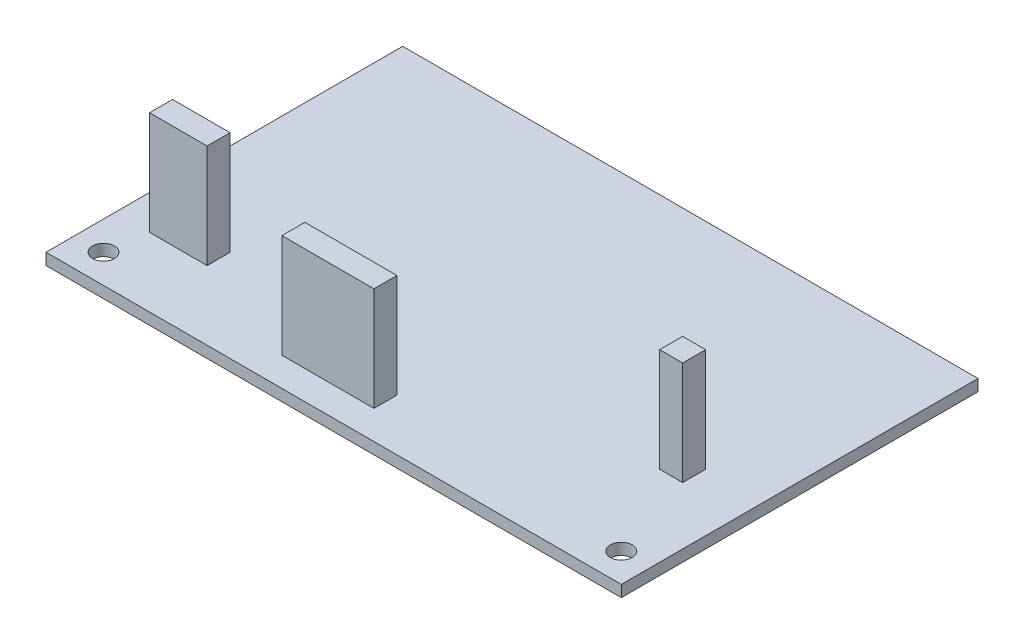
from build123d import *

# Parameters (mm, degrees)
BOSS_EXTRU_7_DEPTH      = 9
BOSS_EXTRU_7_DEPTH_BACK = 1
ESQUISSE1_W             = 8
ESQUISSE1_H             = 2
BOSS_EXTRU_8_DEPTH      = 9
BOSS_EXTRU_8_DEPTH_BACK = 1
ESQUISSE1_10_W          = 5
ESQUISSE1_10_H          = 2
BOSS_EXTRU_9_DEPTH      = 9
BOSS_EXTRU_9_DEPTH_BACK = 1
ESQUISSE1_11_W          = 2
ESQUISSE1_11_H          = 2
ESQUISSE1_12_W          = 50
ESQUISSE1_12_H          = 31
ESQUISSE1_12_R          = 0.95
ESQUISSE1_12_W_2        = 5
ESQUISSE1_12_H_2        = 2
ESQUISSE1_12_W_3        = 8
ESQUISSE1_12_W_4        = 2
BOSS_EXTRU_10_DEPTH     = 1


with BuildPart() as part:
    # Esquisse1 → Boss.-Extru.7 (new, two sides: drawn at the far end of the back side and taken through both)
    with BuildSketch(Plane(origin=(0, 0, 0), x_dir=(1, 0, 0), z_dir=(0, 1, 0)).offset(-BOSS_EXTRU_7_DEPTH_BACK)):
        with Locations((-0.479564033, -17.121253406)):
            Rectangle(ESQUISSE1_W, ESQUISSE1_H)
    extrude(amount=BOSS_EXTRU_7_DEPTH + BOSS_EXTRU_7_DEPTH_BACK)



with BuildPart() as body_2:
    # Esquisse1<10> → Boss.-Extru.8 (new, two sides: drawn at the far end of the back side and taken through both)
    with BuildSketch(Plane(origin=(0, 0, 0), x_dir=(1, 0, 0), z_dir=(0, 1, 0)).offset(-BOSS_EXTRU_8_DEPTH_BACK)):
        with Locations((-16.979564033, -13.621253406)):
            Rectangle(ESQUISSE1_10_W, ESQUISSE1_10_H)
    extrude(amount=BOSS_EXTRU_8_DEPTH + BOSS_EXTRU_8_DEPTH_BACK)


with BuildPart() as body_3:
    # Esquisse1<11> → Boss.-Extru.9 (new, two sides: drawn at the far end of the back side and taken through both)
    with BuildSketch(Plane(origin=(0, 0, 0), x_dir=(1, 0, 0), z_dir=(0, 1, 0)).offset(-BOSS_EXTRU_9_DEPTH_BACK)):
        with Locations((21.520435967, -9.286103542)):
            Rectangle(ESQUISSE1_11_W, ESQUISSE1_11_H)
    extrude(amount=BOSS_EXTRU_9_DEPTH + BOSS_EXTRU_9_DEPTH_BACK)


with BuildPart() as part_1:
    add(part.part)

    add(body_2.part)  # Boss.-Extru.10 merges body 2

    add(body_3.part)  # Boss.-Extru.10 merges body 3
    # Esquisse1<12> → Boss.-Extru.10 (add)
    with BuildSketch(Plane(origin=(0, 0, 0), x_dir=(1, 0, 0), z_dir=(0, 1, 0))):
        with Locations((2.520435967, -5.121253406)):
            Rectangle(ESQUISSE1_12_W, ESQUISSE1_12_H)
        with Locations((-19.979564033, -18.121253406)):
            Circle(ESQUISSE1_12_R, mode=Mode.SUBTRACT)
        with Locations((25.020435967, -18.121253406)):
            Circle(ESQUISSE1_12_R, mode=Mode.SUBTRACT)
        with Locations((-16.979564033, -13.621253406)):
            Rectangle(ESQUISSE1_12_W_2, ESQUISSE1_12_H_2, mode=Mode.SUBTRACT)
        with Locations((-0.479564033, -17.121253406)):
            Rectangle(ESQUISSE1_12_W_3, ESQUISSE1_12_H_2, mode=Mode.SUBTRACT)
        with Locations((21.520435967, -9.286103542)):
            Rectangle(ESQUISSE1_12_W_4, ESQUISSE1_12_H_2, mode=Mode.SUBTRACT)
    extrude(amount=-BOSS_EXTRU_10_DEPTH)


solid = part_1.part
